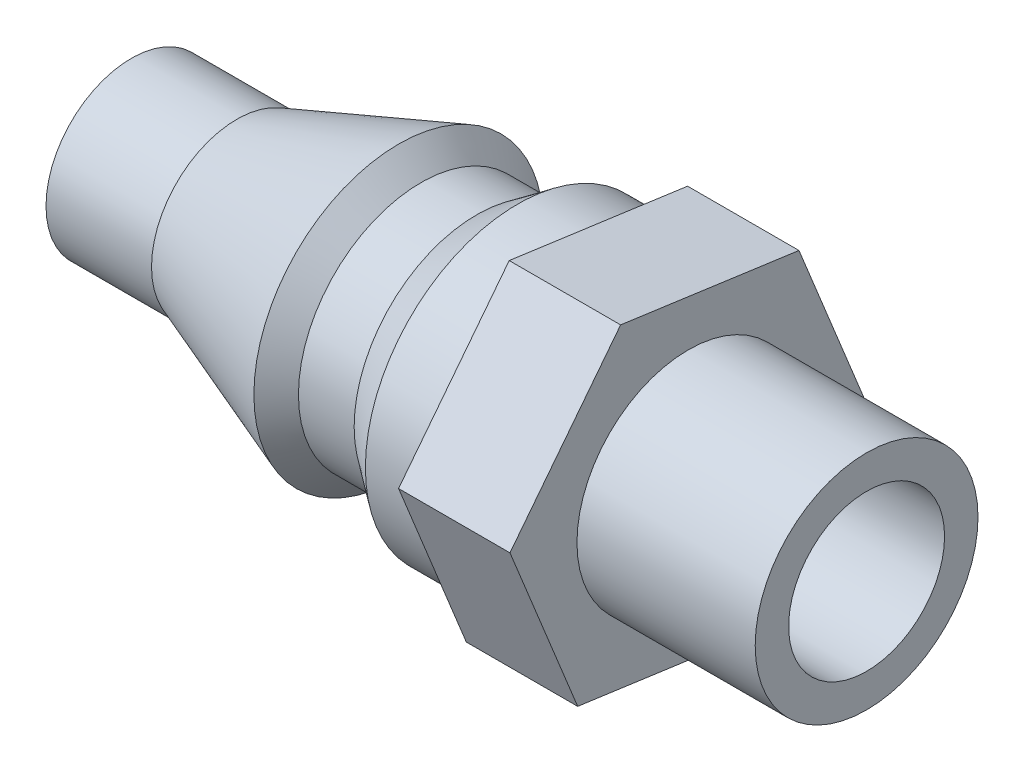
from build123d import *

# Parameters (mm, degrees)
EXTRUDE_1_DEPTH     = 5
SKETCH_3_R          = 5
EXTRUDE_2_DEPTH     = 8
SKETCH_4_R          = 3.5
CUT_EXTRUDE_3_DEPTH = 35.773353009


with BuildPart() as part:
    # 草图1 → 旋转1 (revolve)
    with BuildSketch(Plane(origin=(0, 0, 0), x_dir=(1, 0, 0), z_dir=(0, 1, 0)), mode=Mode.PRIVATE) as revolve_1_sk:
        Polygon((0, 3.047961053), (0, 3.83046551), (4.735897553, 3.83046551), (12, 6.5), (13, 5.5), (15.5, 5.5), (17.339013278, 6.834767245), (20, 6.834767245), (20, 3.417383623), align=None)
    revolve(revolve_1_sk.sketch.rotate(Axis((0, 0, 0), (1, 0, 0)), 180), axis=Axis((0, 0, 0), (1, 0, 0)))

    # 草图2 → 拉伸1 (add)
    with BuildSketch(Plane(origin=(20, 0, 0), x_dir=(0, 0, -1), z_dir=(1, 0, 0))):
        Polygon((8.006144159, -1.111300607), (4.965486636, 6.377873924), (-3.040657522, 7.489174532), (-8.006144159, 1.111300607), (-4.965486636, -6.377873924), (3.040657522, -7.489174532), align=None)
    extrude(amount=EXTRUDE_1_DEPTH)

    # 草图3 → 拉伸2 (add)
    with BuildSketch(Plane(origin=(25, 0, 0), x_dir=(0, 0, -1), z_dir=(1, 0, 0))):
        Circle(SKETCH_3_R)
    extrude(amount=EXTRUDE_2_DEPTH)

    # 草图4 → 拉伸3 (cut, through all)
    with BuildSketch(Plane(origin=(33, 0, 0), x_dir=(0, 0, -1), z_dir=(1, 0, 0))):
        Circle(SKETCH_4_R)
    extrude(amount=-CUT_EXTRUDE_3_DEPTH, mode=Mode.SUBTRACT)


solid = part.part
